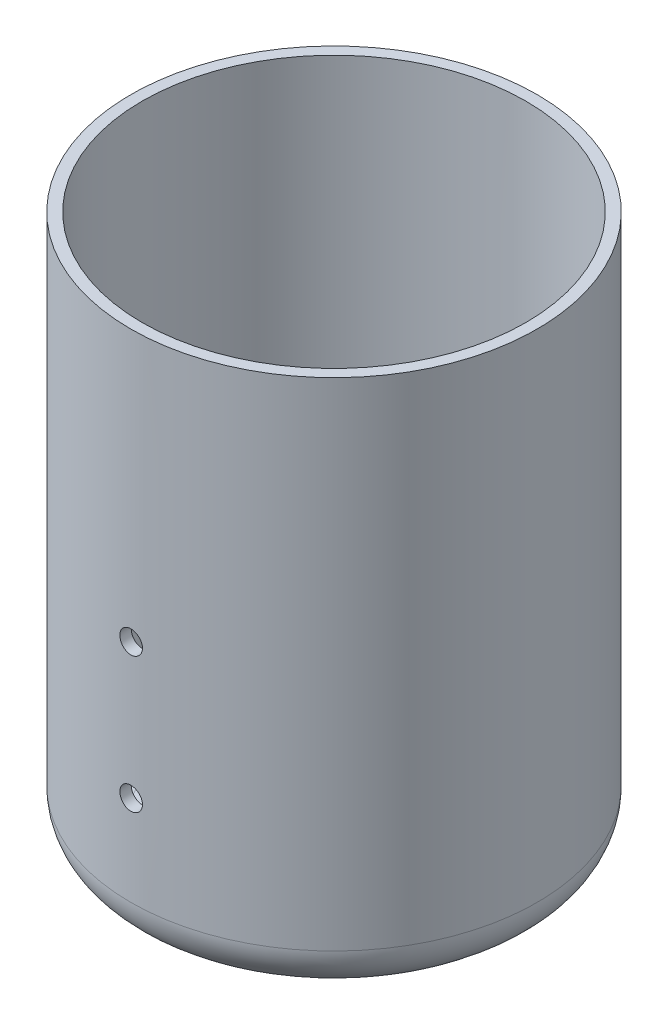
from build123d import *

# Parameters (mm, degrees)
CUT_EXTRUDE1_DEPTH      = 136.830777072
CUT_EXTRUDE1_DEPTH_BACK = 136.830777072
SKETCH2_R               = 6
CUT_EXTRUDE2_DEPTH      = 91.967026993
CUT_EXTRUDE2_DEPTH_BACK = 91.967026993
SKETCH4_R               = 2.5


with BuildPart() as part:
    # Sketch1 → Revolve1 (revolve)
    with BuildSketch(Plane(origin=(0, 0, 0), x_dir=(0, 0, -1), z_dir=(1, 0, 0))):
        with BuildLine():
            Line((-42.5, 55), (-42.5, -52.5))
            ThreePointArc((-42.5, -52.5), (-39.571067812, -59.571067812), (-32.5, -62.5))
            Line((-32.5, -62.5), (0, -62.5))
            Line((0, -62.5), (0, -65))
            Line((0, -65), (-35, -65))
            ThreePointArc((-35, -65), (-42.071067812, -62.071067812), (-45, -55))
            Line((-45, -55), (-45, 55))
            Line((-45, 55), (-42.5, 55))
        make_face()
    revolve(axis=Axis((0, 51.85854301, 0), (0, -1, 0)))

    # Sketch2 → Cut-Extrude1 (cut, two sides: drawn at the far end of the back side and taken through both)
    with BuildSketch(Plane.XZ.offset(65).offset(-CUT_EXTRUDE1_DEPTH_BACK)):
        with Locations(Location((0, 12.5, 0), (0, 0, 270))):
            Circle(SKETCH2_R)
        with Locations(Location((0, -12.5, 0), (0, 0, 270))):
            Circle(SKETCH2_R)
    extrude(amount=CUT_EXTRUDE1_DEPTH + CUT_EXTRUDE1_DEPTH_BACK, mode=Mode.SUBTRACT)

    # Sketch4 → Cut-Extrude2 (cut, two sides: drawn at the far end of the back side and taken through both)
    with BuildSketch(Plane.XY.offset(-CUT_EXTRUDE2_DEPTH_BACK)):
        with Locations(Location((0, -5, 0), (0, 0, 180))):
            Circle(SKETCH4_R)
        with Locations(Location((0, -35, 0), (0, 0, 180))):
            Circle(SKETCH4_R)
    extrude(amount=CUT_EXTRUDE2_DEPTH + CUT_EXTRUDE2_DEPTH_BACK, mode=Mode.SUBTRACT)


solid = part.part
